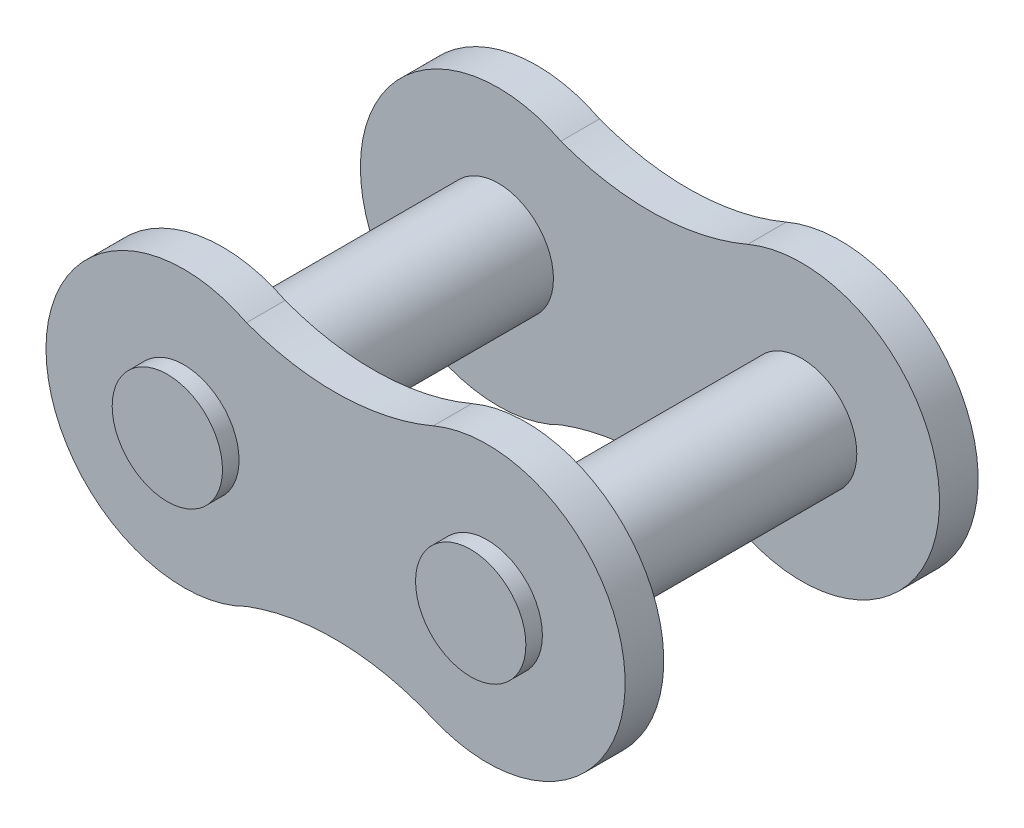
from build123d import *

# Parameters (mm, degrees)
SKETCH1_R           = 1
BOSS_EXTRUDE1_DEPTH = 0.7
SKETCH2_R           = 1
BOSS_EXTRUDE2_DEPTH = 3.5


with BuildPart() as part:
    # Sketch1 → Boss-Extrude1 (new body)
    with BuildSketch(Plane.XY):
        with BuildLine():
            ThreePointArc((-1.614432161, 2.227214781), (-5.25, 0), (-1.614432161, -2.227214781))
            ThreePointArc((-1.614432161, -2.227214781), (0.086080134, -1.938406924), (1.772413942, -2.300940134))
            ThreePointArc((1.772413942, -2.300940134), (5.25, 0), (1.772413942, 2.300940134))
            ThreePointArc((1.772413942, 2.300940134), (0.086080134, 1.938406924), (-1.614432161, 2.227214781))
        make_face()
        with Locations((-2.75, 0)):
            Circle(SKETCH1_R, mode=Mode.SUBTRACT)
        with Locations((2.75, 0)):
            Circle(SKETCH1_R, mode=Mode.SUBTRACT)
    extrude(amount=BOSS_EXTRUDE1_DEPTH)


with BuildPart() as body_2:
    # Mirror1: mirrored copy
    add(part.part.mirror(Plane(origin=(0, 0, -2.5), x_dir=(1, 0, 0), z_dir=(0, 0, -1))))


with BuildPart() as part_1:
    add(part.part)

    add(body_2.part)  # Boss-Extrude2 merges body 2
    # Sketch2 → Boss-Extrude2 (add, symmetric)
    with BuildSketch(Plane(origin=(0, 0, -2.5), x_dir=(-1, 0, 0), z_dir=(0, 0, -1))):
        with Locations(Location((-2.75, 0, 0), (0, 0, 180))):
            Circle(SKETCH2_R)
        with Locations(Location((2.75, 0, 0), (0, 0, 180))):
            Circle(SKETCH2_R)
    extrude(amount=BOSS_EXTRUDE2_DEPTH, both=True)


solid = part_1.part
